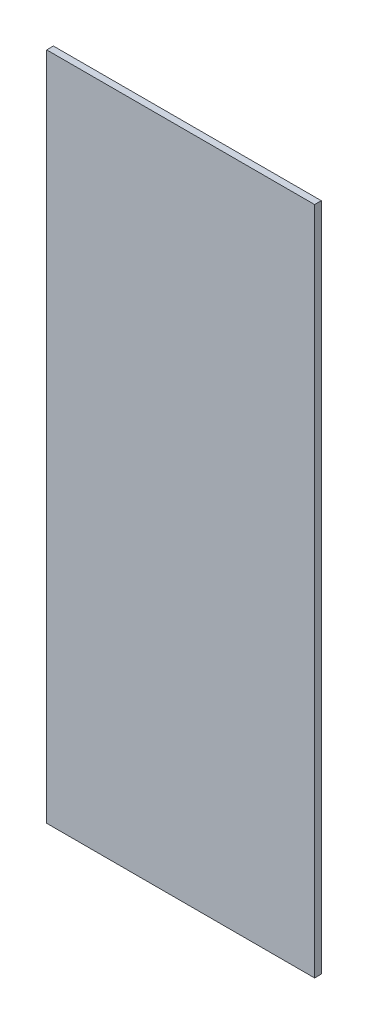
from build123d import *

# Parameters (mm, degrees)
SKETCH1_W           = 317.5
SKETCH1_H           = 127
BOSS_EXTRUDE1_DEPTH = 3.175


with BuildPart() as part:
    # Sketch1 → Boss-Extrude1 (new body)
    with BuildSketch(Plane(origin=(0, 0, 0), x_dir=(0, 1, 0), z_dir=(0, 0, 1))):
        Rectangle(SKETCH1_W, SKETCH1_H)
    extrude(amount=BOSS_EXTRUDE1_DEPTH)


solid = part.part
